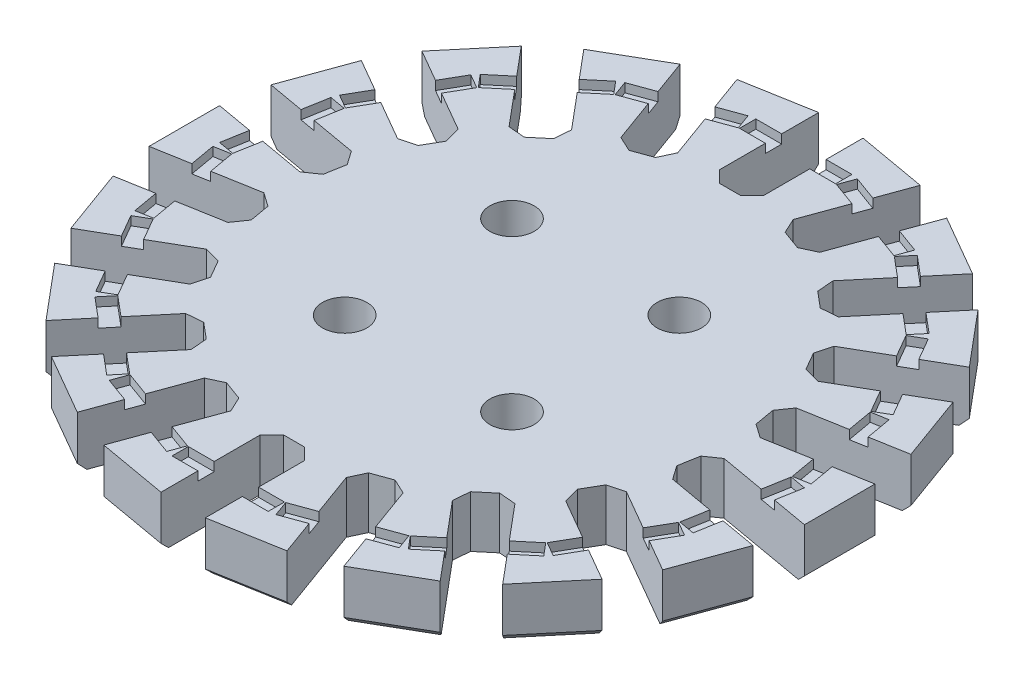
from build123d import *

# Parameters (mm, degrees)
BOSS_EXTRUDE1_DEPTH = 3.5
CHAMFER1_SIZE       = 0.8
SKETCH2_W           = 6.5
SKETCH2_H           = 1.1
CUT_EXTRUDE1_DEPTH  = 0.6
CHAMFER2_SIZE       = 0.5
SKETCH4_R           = 1.5
CUT_EXTRUDE4_DEPTH  = 3.5
SKETCH5_R           = 3
CUT_EXTRUDE5_DEPTH  = 1.1


with BuildPart() as part:
    # Sketch1 → Boss-Extrude1 (new body)
    with BuildSketch(Plane(origin=(0, 0, 0), x_dir=(1, 0, 0), z_dir=(0, 1, 0))):
        Polygon((-1.5, 22.235509529), (-1.5, 14.735509529), (1.5, 14.735509529), (1.5, 22.235509529), (6.195453225, 21.407574439), (3.63030215, 14.359879783), (6.449380012, 13.333819353), (9.014531087, 20.381514009), (13.143643356, 17.997569929), (8.322736283, 12.252236606), (10.620869612, 10.323873777), (15.441776685, 16.0692071), (18.506516118, 12.41679287), (12.01132559, 8.66679287), (13.51132559, 6.068716659), (20.006516118, 9.818716659), (21.63722991, 5.338367339), (14.251171762, 4.036006006), (14.772116295, 1.081582747), (22.158174443, 2.38394408), (22.158174443, -2.38394408), (14.772116295, -1.081582747), (14.251171762, -4.036006006), (21.63722991, -5.338367339), (20.006516118, -9.818716659), (13.51132559, -6.068716659), (12.01132559, -8.66679287), (18.506516118, -12.41679287), (15.441776685, -16.0692071), (10.620869612, -10.323873777), (8.322736283, -12.252236606), (13.143643356, -17.997569929), (9.014531087, -20.381514009), (6.449380012, -13.333819353), (3.63030215, -14.359879783), (6.195453225, -21.407574439), (1.5, -22.235509529), (1.5, -14.735509529), (-1.5, -14.735509529), (-1.5, -22.235509529), (-6.195453225, -21.407574439), (-3.63030215, -14.359879783), (-6.449380012, -13.333819353), (-9.014531087, -20.381514009), (-13.143643356, -17.997569929), (-8.322736283, -12.252236606), (-10.620869612, -10.323873777), (-15.441776685, -16.0692071), (-18.506516118, -12.41679287), (-12.01132559, -8.66679287), (-13.51132559, -6.068716659), (-20.006516118, -9.818716659), (-21.63722991, -5.338367339), (-14.251171762, -4.036006006), (-14.772116295, -1.081582747), (-22.158174443, -2.38394408), (-22.158174443, 2.38394408), (-14.772116295, 1.081582747), (-14.251171762, 4.036006006), (-21.63722991, 5.338367339), (-20.006516118, 9.818716659), (-13.51132559, 6.068716659), (-12.01132559, 8.66679287), (-18.506516118, 12.41679287), (-15.441776685, 16.0692071), (-10.620869612, 10.323873777), (-8.322736283, 12.252236606), (-13.143643356, 17.997569929), (-9.014531087, 20.381514009), (-6.449380012, 13.333819353), (-3.63030215, 14.359879783), (-6.195453225, 21.407574439), align=None)
    extrude(amount=BOSS_EXTRUDE1_DEPTH)

    # Chamfer1
    chamfer1_edges = [part.edges().sort_by_distance(p)[0] for p in [
        (-1.5, 1.75, -14.735509529),
        (1.5, 1.75, -14.735509529),
        (3.63030215, 1.75, -14.359879783),
        (6.449380012, 1.75, -13.333819353),
        (8.322736283, 1.75, -12.252236606),
        (10.620869612, 1.75, -10.323873777),
        (12.01132559, 1.75, -8.66679287),
        (13.51132559, 1.75, -6.068716659),
        (14.251171762, 1.75, -4.036006006),
        (14.772116295, 1.75, -1.081582747),
        (14.772116295, 1.75, 1.081582747),
        (14.251171762, 1.75, 4.036006006),
        (13.51132559, 1.75, 6.068716659),
        (12.01132559, 1.75, 8.66679287),
        (10.620869612, 1.75, 10.323873777),
        (8.322736283, 1.75, 12.252236606),
        (6.449380012, 1.75, 13.333819353),
        (3.63030215, 1.75, 14.359879783),
        (1.5, 1.75, 14.735509529),
        (-1.5, 1.75, 14.735509529),
        (-3.63030215, 1.75, 14.359879783),
        (-6.449380012, 1.75, 13.333819353),
        (-8.322736283, 1.75, 12.252236606),
        (-10.620869612, 1.75, 10.323873777),
        (-12.01132559, 1.75, 8.66679287),
        (-13.51132559, 1.75, 6.068716659),
        (-14.251171762, 1.75, 4.036006006),
        (-14.772116295, 1.75, 1.081582747),
        (-14.772116295, 1.75, -1.081582747),
        (-14.251171762, 1.75, -4.036006006),
        (-13.51132559, 1.75, -6.068716659),
        (-12.01132559, 1.75, -8.66679287),
        (-10.620869612, 1.75, -10.323873777),
        (-8.322736283, 1.75, -12.252236606),
        (-6.449380012, 1.75, -13.333819353),
        (-3.63030215, 1.75, -14.359879783),
    ]]
    chamfer(chamfer1_edges, length=CHAMFER1_SIZE)

    # Sketch2 → Cut-Extrude1 (cut)
    with BuildSketch(Plane(origin=(0, 3.5, 0), x_dir=(1, 0, 0), z_dir=(0, 1, 0))):
        with Locations((0, 19.185509529)):
            Rectangle(SKETCH2_W, SKETCH2_H)
        Polygon((3.319718622, 18.623216255), (3.69594078, 19.656878138), (9.803942815, 17.433747206), (9.427720658, 16.400085323), align=None)
        Polygon((9.489030185, 16.364688251), (10.196096556, 17.207337138), (15.175385436, 13.029217675), (14.468319066, 12.186568788), align=None)
        Polygon((14.513824665, 12.132337327), (15.466452609, 12.682337327), (18.716452609, 7.053172202), (17.763824665, 6.503172202), align=None)
        Polygon((17.788037688, 6.436647467), (18.871326216, 6.627660462), (20.000039371, 0.226410068), (18.916750843, 0.035397072), align=None)
        Polygon((18.916750843, -0.035397072), (20.000039371, -0.226410068), (18.871326216, -6.627660462), (17.788037688, -6.436647467), align=None)
        Polygon((17.763824665, -6.503172202), (18.716452609, -7.053172202), (15.466452609, -12.682337327), (14.513824665, -12.132337327), align=None)
        Polygon((14.468319066, -12.186568788), (15.175385436, -13.029217675), (10.196096556, -17.207337138), (9.489030185, -16.364688251), align=None)
        Polygon((9.427720658, -16.400085323), (9.803942815, -17.433747206), (3.69594078, -19.656878138), (3.319718622, -18.623216255), align=None)
        with Locations((0, -19.185509529)):
            Rectangle(SKETCH2_W, SKETCH2_H)
        Polygon((-3.319718622, -18.623216255), (-3.69594078, -19.656878138), (-9.803942815, -17.433747206), (-9.427720658, -16.400085323), align=None)
        Polygon((-9.489030185, -16.364688251), (-10.196096556, -17.207337138), (-15.175385436, -13.029217675), (-14.468319066, -12.186568788), align=None)
        Polygon((-14.513824665, -12.132337327), (-15.466452609, -12.682337327), (-18.716452609, -7.053172202), (-17.763824665, -6.503172202), align=None)
        Polygon((-17.788037688, -6.436647467), (-18.871326216, -6.627660462), (-20.000039371, -0.226410068), (-18.916750843, -0.035397072), align=None)
        Polygon((-18.916750843, 0.035397072), (-20.000039371, 0.226410068), (-18.871326216, 6.627660462), (-17.788037688, 6.436647467), align=None)
        Polygon((-17.763824665, 6.503172202), (-18.716452609, 7.053172202), (-15.466452609, 12.682337327), (-14.513824665, 12.132337327), align=None)
        Polygon((-14.468319066, 12.186568788), (-15.175385436, 13.029217675), (-10.196096556, 17.207337138), (-9.489030185, 16.364688251), align=None)
        Polygon((-9.427720658, 16.400085323), (-9.803942815, 17.433747206), (-3.69594078, 19.656878138), (-3.319718622, 18.623216255), align=None)
    extrude(amount=-CUT_EXTRUDE1_DEPTH, mode=Mode.SUBTRACT)

    # Chamfer2
    chamfer2_edges = [part.edges().sort_by_distance(p)[0] for p in [
        (3.847726612, 0, -21.821541984),
        (11.079087221, 0, -19.189541969),
        (16.974146402, 0, -14.242999985),
        (20.821873014, 0, -7.578541999),
        (22.158174443, 0, 0),
        (20.821873014, 0, 7.578541999),
        (16.974146402, 0, 14.242999985),
        (11.079087221, 0, 19.189541969),
        (3.847726612, 0, 21.821541984),
        (-3.847726612, 0, 21.821541984),
        (-11.079087221, 0, 19.189541969),
        (-16.974146402, 0, 14.242999985),
        (-20.821873014, 0, 7.578541999),
        (-22.158174443, 0, 0),
        (-20.821873014, 0, -7.578541999),
        (-16.974146402, 0, -14.242999985),
        (-11.079087221, 0, -19.189541969),
        (-3.847726612, 0, -21.821541984),
    ]]
    chamfer(chamfer2_edges, length=CHAMFER2_SIZE)

    # Sketch4 → Cut-Extrude4 (cut)
    with BuildSketch(Plane.XZ):
        with Locations(Location((-5.656854249, 5.656854249, 0), (0, 0, 270))):
            Circle(SKETCH4_R)
        with Locations(Location((5.656854249, 5.656854249, 0), (0, 0, 270))):
            Circle(SKETCH4_R)
        with Locations(Location((5.656854249, -5.656854249, 0), (0, 0, 270))):
            Circle(SKETCH4_R)
        with Locations(Location((-5.656854249, -5.656854249, 0), (0, 0, 270))):
            Circle(SKETCH4_R)
    extrude(amount=-CUT_EXTRUDE4_DEPTH, mode=Mode.SUBTRACT)

    # Sketch5 → Cut-Extrude5 (cut)
    with BuildSketch(Plane.XZ):
        with Locations(Location((-5.656854249, 5.656854249, 0), (0, 0, 270))):
            Circle(SKETCH5_R)
        with Locations(Location((5.656854249, -5.656854249, 0), (0, 0, 270))):
            Circle(SKETCH5_R)
        with Locations(Location((-5.656854249, -5.656854249, 0), (0, 0, 270))):
            Circle(SKETCH5_R)
        with Locations(Location((5.656854249, 5.656854249, 0), (0, 0, 270))):
            Circle(SKETCH5_R)
    extrude(amount=-CUT_EXTRUDE5_DEPTH, mode=Mode.SUBTRACT)


solid = part.part
